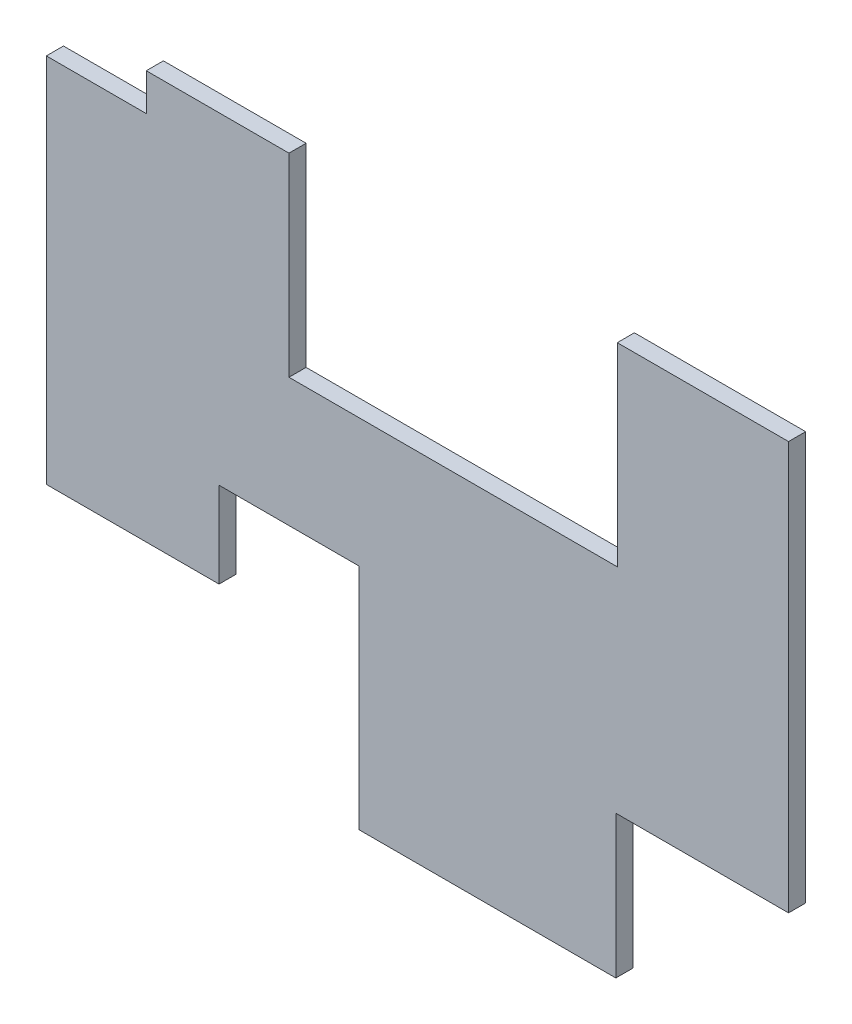
from build123d import *

# Parameters (mm, degrees)
RESSALTO_EXTRUS_O1_DEPTH = 6


with BuildPart() as part:
    # Esboço1 → Ressalto-extrusão1 (new body)
    with BuildSketch(Plane.XY):
        Polygon((-45, 28.5), (-45, 96.5), (-95, 96.5), (-95, 83.5), (-130, 83.5), (-130, -46.5), (-69.5, -46.5), (-69.5, -16.5), (-20.5, -16.5), (-20.5, -96.5), (69.5, -96.5), (69.5, -46.5), (130, -46.5), (130, 96.5), (70, 96.5), (70, 28.5), align=None)
    extrude(amount=RESSALTO_EXTRUS_O1_DEPTH)


solid = part.part
